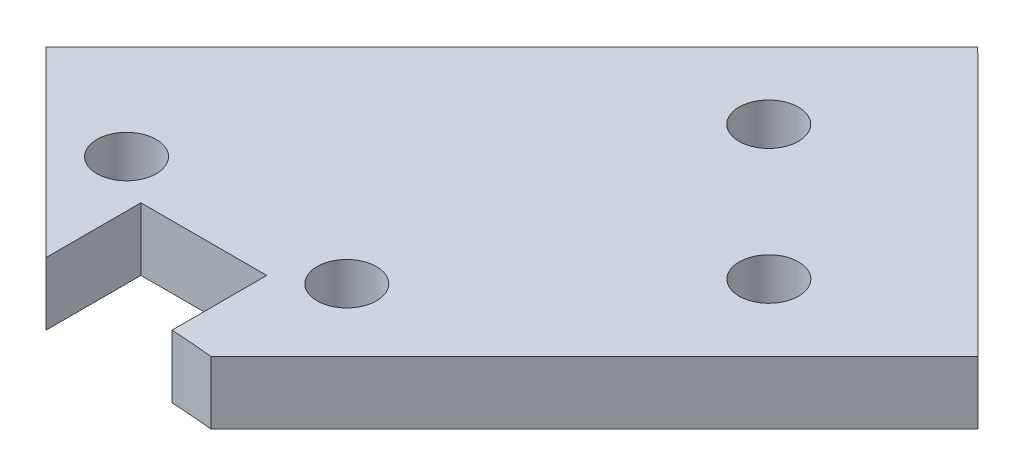
from build123d import *

# Parameters (mm, degrees)
SKETCH1_R           = 1.5
SKETCH1_R_2         = 55
BOSS_EXTRUDE1_DEPTH = 3.175
CUT_EXTRUDE3_DEPTH  = 140.736059076
CUT_EXTRUDE4_START  = -10
SKETCH3_R           = 1.5
CUT_EXTRUDE4_DEPTH  = 10
CUT_EXTRUDE5_DEPTH  = 140.736059076
CUT_EXTRUDE6_DEPTH  = 140.736059076
SKETCH6_R           = 1.5
CUT_EXTRUDE7_DEPTH  = 124.953233311
SKETCH7_W           = 69.762043991
SKETCH7_H           = 61.208981149
CUT_EXTRUDE8_DEPTH  = 100


with BuildPart() as part:
    # Sketch1 → Boss-Extrude1 (new body)
    with BuildSketch(Plane(origin=(0, 0, 0), x_dir=(1, 0, 0), z_dir=(0, 1, 0))):
        Polygon((0.047005036, -98.782806148), (-98.782806148, -0.047005036), (-0.047005036, 98.782806148), (98.782806148, 0.047005036), align=None)
        with Locations(Location((-61.346730494, 5.55625, 0), (0, 0, 270))):
            Circle(SKETCH1_R, mode=Mode.SUBTRACT)
        with Locations(Location((-61.346730494, -5.55625, 0), (0, 0, 270))):
            Circle(SKETCH1_R, mode=Mode.SUBTRACT)
        with Locations(Location((-5.55625, -61.346730494, 0), (0, 0, 270))):
            Circle(SKETCH1_R, mode=Mode.SUBTRACT)
        with Locations(Location((5.55625, -61.346730494, 0), (0, 0, 270))):
            Circle(SKETCH1_R, mode=Mode.SUBTRACT)
        with Locations(Location((61.346730494, -5.55625, 0), (0, 0, 270))):
            Circle(SKETCH1_R, mode=Mode.SUBTRACT)
        with Locations(Location((61.346730494, 5.55625, 0), (0, 0, 270))):
            Circle(SKETCH1_R, mode=Mode.SUBTRACT)
        with Locations(Location((5.55625, 61.346730494, 0), (0, 0, 270))):
            Circle(SKETCH1_R, mode=Mode.SUBTRACT)
        with Locations(Location((-5.55625, 61.346730494, 0), (0, 0, 270))):
            Circle(SKETCH1_R, mode=Mode.SUBTRACT)
        with Locations(Location((0, 0, 0), (0, 0, 270))):
            Circle(SKETCH1_R_2, mode=Mode.SUBTRACT)
    extrude(amount=BOSS_EXTRUDE1_DEPTH)

    # Sketch2 → Cut-Extrude3 (cut, through all)
    with BuildSketch(Plane(origin=(0, 3.175, 0), x_dir=(1, 0, 0), z_dir=(0, 1, 0))):
        Polygon((3.175, 53.34), (3.175, 59.69), (-3.175, 59.69), (-3.175, 53.34), (-3.175, 52.244537665), (3.175, 52.244537665), align=None)
        Polygon((53.34, -3.175), (59.69, -3.175), (59.69, 3.175), (53.34, 3.175), (52.244537665, 3.175), (52.244537665, -3.175), align=None)
        Polygon((-3.175, -53.34), (-3.175, -59.69), (3.175, -59.69), (3.175, -53.34), (3.175, -52.244537665), (-3.175, -52.244537665), align=None)
        Polygon((-53.34, 3.175), (-59.69, 3.175), (-59.69, -3.175), (-53.34, -3.175), (-52.244537665, -3.175), (-52.244537665, 3.175), align=None)
    extrude(amount=-CUT_EXTRUDE3_DEPTH, mode=Mode.SUBTRACT)

    # Sketch3 → Cut-Extrude4 (cut)
    # profile 1 of 3: a face of its own
    with BuildSketch(Plane(origin=(0, 3.175, 0), x_dir=(1, 0, 0), z_dir=(0, 1, 0)).offset(CUT_EXTRUDE4_START)):
        with BuildLine():
            Line((38.872362643, 38.909374482), (49.367900556, 49.414905592))
            Line((49.367900556, 49.414905592), (24.66044776, 74.09885587))
            Line((24.66044776, 74.09885587), (5.321919094, 54.741914263))
            ThreePointArc((5.321919094, 54.741914263), (23.472344653, 49.739813394), (38.872362643, 38.909374482))
        make_face()
    # profile 2 of 3: a face of its own
    with BuildSketch(Plane(origin=(0, 3.175, 0), x_dir=(1, 0, 0), z_dir=(0, 1, 0)).offset(CUT_EXTRUDE4_START)):
        with BuildLine():
            Line((-49.367900556, -49.414905592), (-38.872362643, -38.909374482))
            ThreePointArc((-38.872362643, -38.909374482), (-49.717452606, -23.519670626), (-54.736824686, -5.374013707))
            Line((-54.736824686, -5.374013707), (-74.075353352, -24.730955314))
            Line((-74.075353352, -24.730955314), (-49.367900556, -49.414905592))
        make_face()
    # profile 3 of 3: a face of its own
    with BuildSketch(Plane(origin=(0, 3.175, 0), x_dir=(1, 0, 0), z_dir=(0, 1, 0)).offset(CUT_EXTRUDE4_START)):
        with BuildLine():
            Line((98.782806148, 0.047005036), (49.367900556, 49.414905592))
            Line((49.367900556, 49.414905592), (38.872362643, 38.909374482))
            ThreePointArc((38.872362643, 38.909374482), (50.179066182, 22.518022052), (54.908281479, 3.175))
            Line((54.908281479, 3.175), (59.69, 3.175))
            Line((59.69, 3.175), (59.69, -3.175))
            Line((59.69, -3.175), (54.908281479, -3.175))
            ThreePointArc((54.908281479, -3.175), (38.890872965, -38.890872965), (3.175, -54.908281479))
            Line((3.175, -54.908281479), (3.175, -59.69))
            Line((3.175, -59.69), (-3.175, -59.69))
            Line((-3.175, -59.69), (-3.175, -54.908281479))
            ThreePointArc((-3.175, -54.908281479), (-22.494142184, -50.189775527), (-38.872362643, -38.909374482))
            Line((-38.872362643, -38.909374482), (-49.367900556, -49.414905592))
            Line((-49.367900556, -49.414905592), (0.047005036, -98.782806148))
            Line((0.047005036, -98.782806148), (98.782806148, 0.047005036))
        make_face()
        with Locations((-5.55625, -61.346730494)):
            Circle(SKETCH3_R, mode=Mode.SUBTRACT)
        with Locations((5.55625, -61.346730494)):
            Circle(SKETCH3_R, mode=Mode.SUBTRACT)
        with Locations((61.346730494, -5.55625)):
            Circle(SKETCH3_R, mode=Mode.SUBTRACT)
        with Locations((61.346730494, 5.55625)):
            Circle(SKETCH3_R, mode=Mode.SUBTRACT)
    extrude(amount=CUT_EXTRUDE4_DEPTH, mode=Mode.SUBTRACT)

    # Sketch4 → Cut-Extrude5 (cut, through all)
    with BuildSketch(Plane(origin=(0, 3.175, 0), x_dir=(1, 0, 0), z_dir=(0, 1, 0))):
        Polygon((-54.908281479, 3.175), (-75.255419375, 23.502783048), (-23.546766486, 75.260669691), (-3.175, 54.908281479), align=None)
    extrude(amount=-CUT_EXTRUDE5_DEPTH, mode=Mode.SUBTRACT)


with BuildPart() as cut_extrude5_piece_1:
    # of the separate pieces the step leaves, piece 1, a body of its own (cut_extrude5_pieces)
    add(part.part.solids().sort_by_distance((-74.075353352, 0, 24.730955314))[0])


with BuildPart() as cut_extrude5_piece_2:
    # of the separate pieces the step leaves, piece 2, a body of its own (cut_extrude5_pieces)
    add(part.part.solids().sort_by_distance((-3.175, 0, -54.908281479))[0])


with BuildPart() as cut_extrude6_tool:
    # Sketch5 → Cut-Extrude6 (new, through all)
    with BuildSketch(Plane(origin=(0, 3.175, 0), x_dir=(1, 0, 0), z_dir=(0, 1, 0))):
        Polygon((-0.047005036, 98.782806148), (11.121699276, 87.624725864), (-87.614101836, -11.205085321), (-98.782806148, -0.047005036), align=None)
    extrude(amount=-CUT_EXTRUDE6_DEPTH)


with BuildPart() as cut_extrude5_piece_1_1:
    add(cut_extrude5_piece_1.part)

    # Cut-Extrude6: cut by cut_extrude6_tool
    add(cut_extrude6_tool.part, mode=Mode.SUBTRACT)


with BuildPart() as cut_extrude5_piece_2_1:
    add(cut_extrude5_piece_2.part)

    # Cut-Extrude6: cut by cut_extrude6_tool
    add(cut_extrude6_tool.part, mode=Mode.SUBTRACT)


with BuildPart() as cut_extrude7_tool:
    # Sketch6 → Cut-Extrude7 (new, through all)
    with BuildSketch(Plane(origin=(0, 3.175, 0), x_dir=(1, 0, 0), z_dir=(0, 1, 0))):
        with BuildLine():
            ThreePointArc((-73.220428508, -14.983508678), (-73.219419094, -17.104828781), (-71.09809899, -17.103819368))
            Line((-71.09809899, -17.103819368), (-73.220428508, -14.983508678))
        make_face()
        with BuildLine():
            Line((-73.220428508, -14.983508678), (-71.09809899, -17.103819368))
            ThreePointArc((-71.09809899, -17.103819368), (-70.773307917, -16.617359439), (-70.659263749, -16.043664023))
            ThreePointArc((-70.659263749, -16.043664023), (-71.585568332, -14.657708191), (-73.220428508, -14.983508678))
        make_face()
        with BuildLine():
            ThreePointArc((-79.989802749, -8.220573681), (-79.988793336, -10.341893785), (-77.867473232, -10.340884371))
            Line((-77.867473232, -10.340884371), (-79.989802749, -8.220573681))
        make_face()
        with BuildLine():
            Line((-79.989802749, -8.220573681), (-77.867473232, -10.340884371))
            ThreePointArc((-77.867473232, -10.340884371), (-77.542682159, -9.854424443), (-77.428637991, -9.280729026))
            ThreePointArc((-77.428637991, -9.280729026), (-78.354942574, -7.894773194), (-79.989802749, -8.220573681))
        make_face()
        with Locations(Location((16.002609239, 72.202151202, 0), (0, 0, 270))):
            Circle(SKETCH6_R)
        with Locations(Location((9.233234997, 78.965086199, 0), (0, 0, 270))):
            Circle(SKETCH6_R)
    extrude(amount=-CUT_EXTRUDE7_DEPTH)


with BuildPart() as cut_extrude5_piece_1_2:
    add(cut_extrude5_piece_1_1.part)

    # Cut-Extrude7: cut by cut_extrude7_tool
    add(cut_extrude7_tool.part, mode=Mode.SUBTRACT)

    # Sketch7 → Cut-Extrude8 (cut)
    with BuildSketch(Plane(origin=(-49.367900556, 0, 49.414905592), x_dir=(0.7074431724013648, 0, 0.7067702298644821), z_dir=(-0.7067702298644821, 0, 0.7074431724013648))):
        with Locations((-46.400178309, 4.239305035)):
            Rectangle(SKETCH7_W, SKETCH7_H)
    extrude(amount=-CUT_EXTRUDE8_DEPTH, mode=Mode.SUBTRACT)


with BuildPart() as cut_extrude5_piece_2_2:
    add(cut_extrude5_piece_2_1.part)

    # Cut-Extrude7: cut by cut_extrude7_tool
    add(cut_extrude7_tool.part, mode=Mode.SUBTRACT)


solid = cut_extrude5_piece_2_2.part
